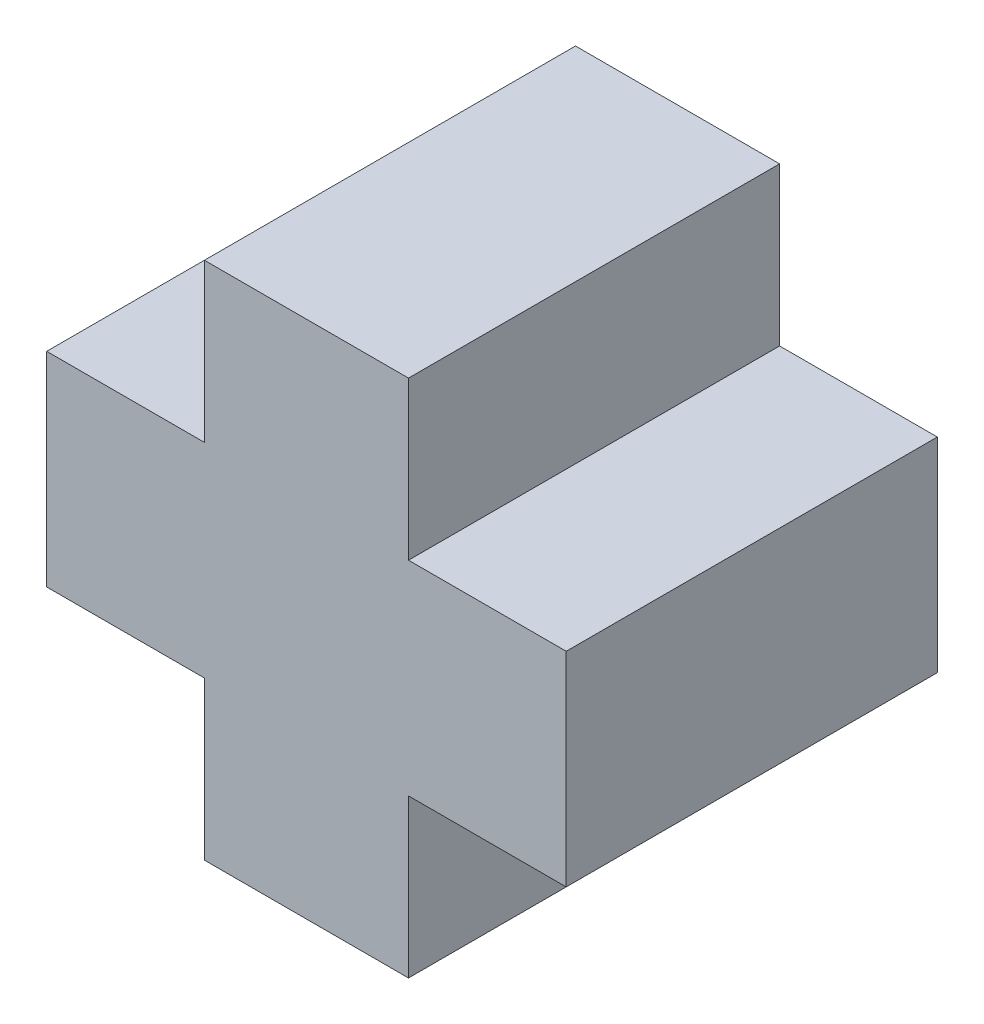
from build123d import *

# Parameters (mm, degrees)
BOSS_EXTRUDE1_DEPTH = 10


with BuildPart() as part:
    # Sketch1 → Boss-Extrude1 (new body)
    with BuildSketch(Plane.XY):
        Polygon((-2.75, 2.75), (-2.75, 7), (2.75, 7), (2.75, 2.75), (7, 2.75), (7, -2.75), (2.75, -2.75), (2.75, -7), (-2.75, -7), (-2.75, -2.75), (-7, -2.75), (-7, 2.75), align=None)
    extrude(amount=BOSS_EXTRUDE1_DEPTH)


solid = part.part
